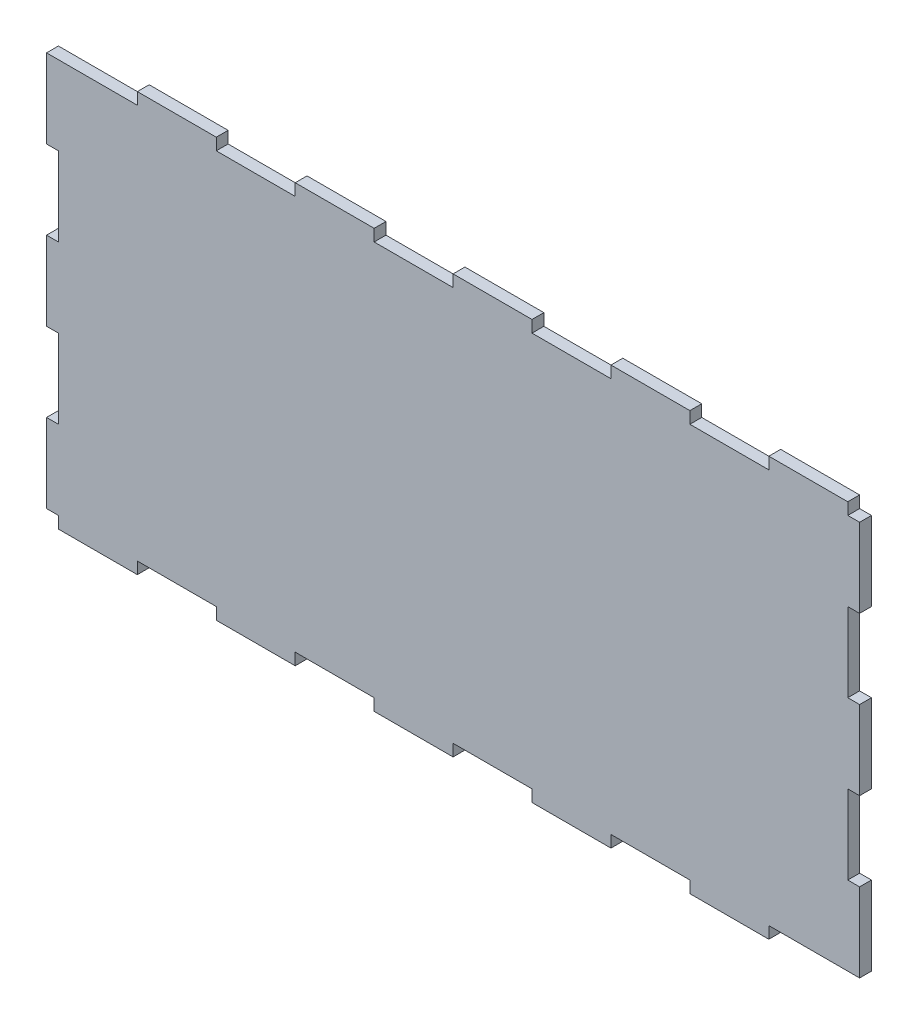
from build123d import *

# Parameters (mm, degrees)
BOSS_EXTRUDE1_DEPTH = 3


with BuildPart() as part:
    # Sketch1 → Boss-Extrude1 (new body)
    with BuildSketch(Plane.XY):
        Polygon((70.190369541, 52.74356103), (70.190369541, 55.74356103), (50.190369541, 55.74356103), (50.190369541, 52.74356103), (30.190369541, 52.74356103), (30.190369541, 55.74356103), (10.190369541, 55.74356103), (10.190369541, 52.74356103), (-9.809630459, 52.74356103), (-9.809630459, 55.74356103), (-29.809630459, 55.74356103), (-29.809630459, 52.74356103), (-49.809630459, 52.74356103), (-49.809630459, 55.74356103), (-69.809630459, 55.74356103), (-69.809630459, 52.74356103), (-89.809630459, 52.74356103), (-92.809630459, 52.74356103), (-92.809630459, 32.74356103), (-89.809630459, 32.74356103), (-89.809630459, 12.74356103), (-92.809630459, 12.74356103), (-92.809630459, -7.25643897), (-89.809630459, -7.25643897), (-89.809630459, -27.25643897), (-92.809630459, -27.25643897), (-92.809630459, -47.25643897), (-89.809630459, -47.25643897), (-89.809630459, -50.25643897), (-69.809630459, -50.25643897), (-69.809630459, -47.25643897), (-49.809630459, -47.25643897), (-49.809630459, -50.25643897), (-29.809630459, -50.25643897), (-29.809630459, -47.25643897), (-9.809630459, -47.25643897), (-9.809630459, -50.25643897), (10.190369541, -50.25643897), (10.190369541, -47.25643897), (30.190369541, -47.25643897), (30.190369541, -50.25643897), (50.190369541, -50.25643897), (50.190369541, -47.25643897), (70.190369541, -47.25643897), (70.190369541, -50.25643897), (90.190369541, -50.25643897), (90.190369541, -47.25643897), (110.190369541, -47.25643897), (113.190369541, -47.25643897), (113.190369541, -27.25643897), (110.190369541, -27.25643897), (110.190369541, -7.25643897), (113.190369541, -7.25643897), (113.190369541, 12.74356103), (110.190369541, 12.74356103), (110.190369541, 32.74356103), (113.190369541, 32.74356103), (113.190369541, 52.74356103), (110.190369541, 52.74356103), (110.190369541, 55.74356103), (90.190369541, 55.74356103), (90.190369541, 52.74356103), align=None)
    extrude(amount=BOSS_EXTRUDE1_DEPTH)


solid = part.part
